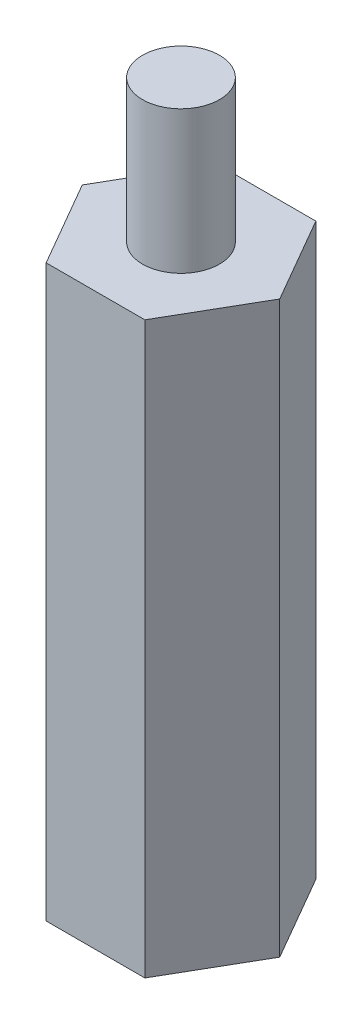
from build123d import *

# Parameters (mm, degrees)
EXTRUDE_1_DEPTH     = 20
SKETCH_2_R          = 1.35
EXTRUDE_2_DEPTH     = 5
SKETCH_3_R          = 1.35
CUT_EXTRUDE_1_DEPTH = 4


with BuildPart() as part:
    # 스케치1 → 보스-돌출1 (new body)
    with BuildSketch(Plane(origin=(0, 0, 0), x_dir=(1, 0, 0), z_dir=(0, 1, 0))):
        Polygon((3.464101615, 0), (1.732050808, 3), (-1.732050808, 3), (-3.464101615, 0), (-1.732050808, -3), (1.732050808, -3), align=None)
    extrude(amount=EXTRUDE_1_DEPTH)

    # 스케치2 → 보스-돌출2 (add)
    with BuildSketch(Plane(origin=(0, 20, 0), x_dir=(1, 0, 0), z_dir=(0, 1, 0))):
        with Locations(Location((0, 0, 0), (0, 0, 270))):
            Circle(SKETCH_2_R)
    extrude(amount=EXTRUDE_2_DEPTH)

    # 스케치3 → 컷-돌출1 (cut)
    with BuildSketch(Plane.XZ):
        with Locations(Location((0, 0, 0), (0, 0, 90))):
            Circle(SKETCH_3_R)
    extrude(amount=-CUT_EXTRUDE_1_DEPTH, mode=Mode.SUBTRACT)


solid = part.part
